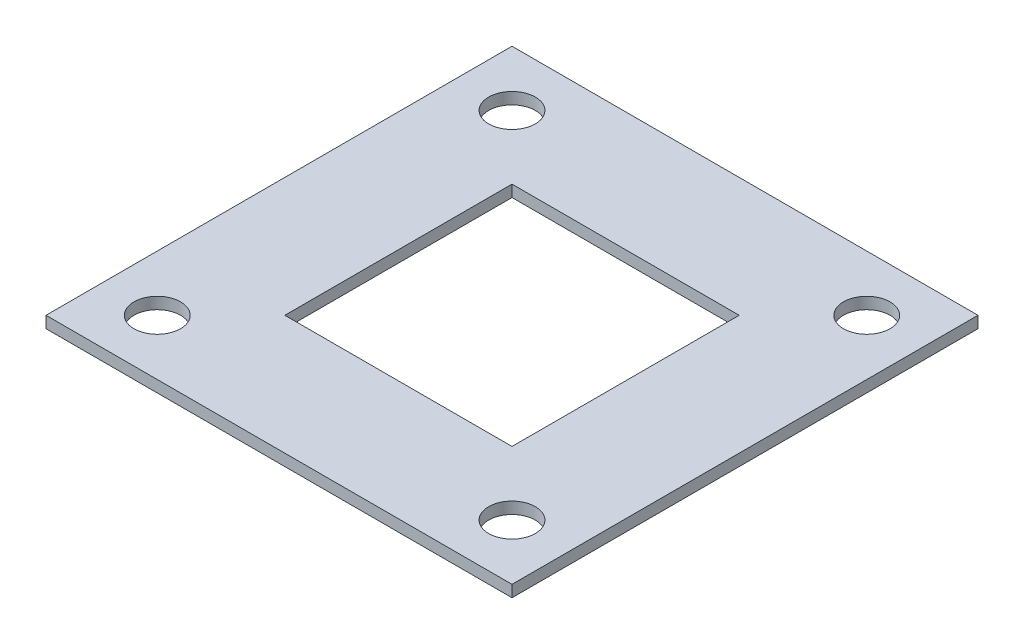
from build123d import *

# Parameters (mm, degrees)
SKETCH_2_W          = 40
SKETCH_2_H          = 40
EXTRUDE_2_DEPTH     = 1
SKETCH_3_R          = 2
CUT_EXTRUDE_2_DEPTH = 10
SKETCH_2_10_W       = 19.5
SKETCH_2_10_H       = 19.5
CUT_EXTRUDE_3_DEPTH = 10


with BuildPart() as part:
    # 草图2 → 凸台-拉伸2 (new body)
    with BuildSketch(Plane(origin=(0, 0, 0), x_dir=(1, 0, 0), z_dir=(0, 1, 0))):
        Rectangle(SKETCH_2_W, SKETCH_2_H)
    extrude(amount=EXTRUDE_2_DEPTH)

    # 草图3 → 切除-拉伸2 (cut)
    with BuildSketch(Plane(origin=(0, 0, 0), x_dir=(1, 0, 0), z_dir=(0, 1, 0))):
        with Locations((-15.224798987, -15.224798987)):
            Circle(SKETCH_3_R)
        with Locations((15.224798987, -15.224798987)):
            Circle(SKETCH_3_R)
        with Locations((15.224798987, 15.224798987)):
            Circle(SKETCH_3_R)
        with Locations((-15.224798987, 15.224798987)):
            Circle(SKETCH_3_R)
    extrude(amount=CUT_EXTRUDE_2_DEPTH, mode=Mode.SUBTRACT)

    # 草图2<10> → 切除-拉伸3 (cut)
    with BuildSketch(Plane(origin=(0, 0, 0), x_dir=(1, 0, 0), z_dir=(0, 1, 0))):
        Rectangle(SKETCH_2_10_W, SKETCH_2_10_H)
    extrude(amount=CUT_EXTRUDE_3_DEPTH, mode=Mode.SUBTRACT)


solid = part.part
